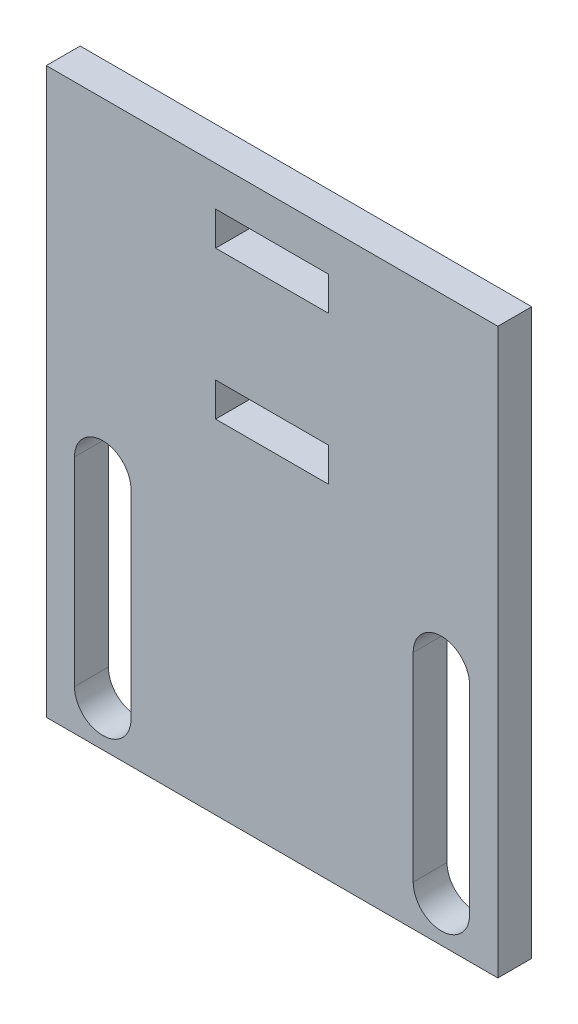
from build123d import *

# Parameters (mm, degrees)
SKETCH1_W           = 40
SKETCH1_H           = 50
SKETCH1_W_2         = 10
SKETCH1_H_2         = 3
BOSS_EXTRUDE1_DEPTH = 3


with BuildPart() as part:
    # Sketch1 → Boss-Extrude1 (new body)
    with BuildSketch(Plane.XY):
        Rectangle(SKETCH1_W, SKETCH1_H)
        with Locations((0, 19.992227475)):
            Rectangle(SKETCH1_W_2, SKETCH1_H_2, mode=Mode.SUBTRACT)
        with Locations((0, 6.878051322)):
            Rectangle(SKETCH1_W_2, SKETCH1_H_2, mode=Mode.SUBTRACT)
        with BuildLine():
            Line((-12.5, -3.7753024), (-12.5, -21.394229107))
            ThreePointArc((-12.5, -21.394229107), (-15, -23.894229107), (-17.5, -21.394229107))
            Line((-17.5, -21.394229107), (-17.5, -3.7753024))
            ThreePointArc((-17.5, -3.7753024), (-15, -1.2753024), (-12.5, -3.7753024))
        make_face(mode=Mode.SUBTRACT)
        with BuildLine():
            Line((12.5, -3.7753024), (12.5, -21.394229107))
            ThreePointArc((12.5, -21.394229107), (15, -23.894229107), (17.5, -21.394229107))
            Line((17.5, -21.394229107), (17.5, -3.7753024))
            ThreePointArc((17.5, -3.7753024), (15, -1.2753024), (12.5, -3.7753024))
        make_face(mode=Mode.SUBTRACT)
    extrude(amount=BOSS_EXTRUDE1_DEPTH)


solid = part.part
